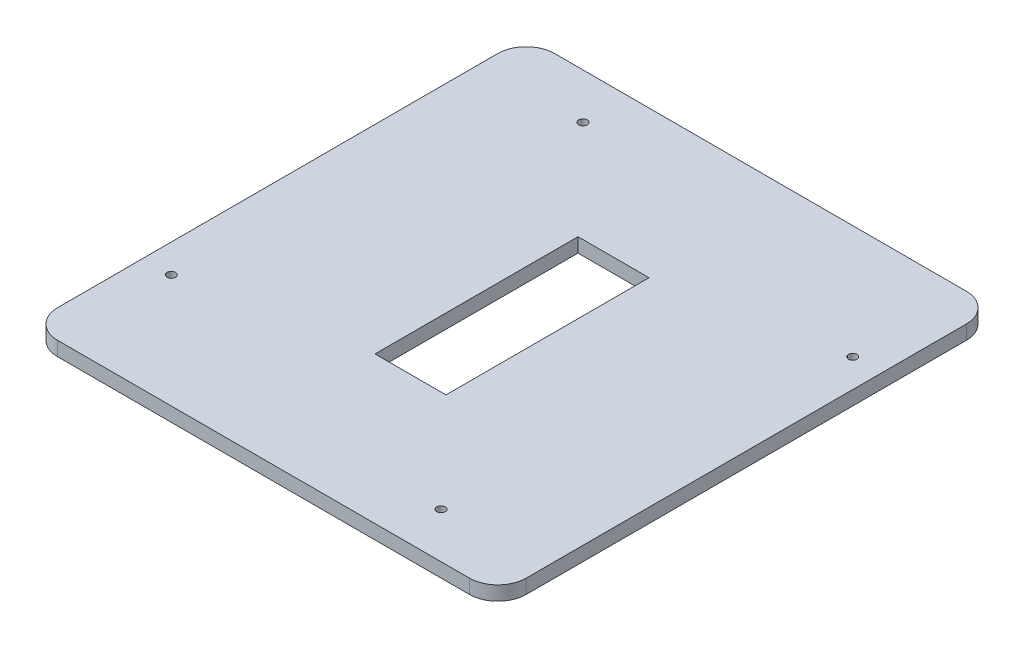
from build123d import *

# Parameters (mm, degrees)
RESSALTO_EXTRUS_O1_DEPTH = 5
ESBO_O2_R                = 1.5
CORTE_EXTRUS_O1_DEPTH    = 5
ESBO_O3_W                = 25
ESBO_O3_H                = 71.5
CORTE_EXTRUS_O2_DEPTH    = 5


with BuildPart() as part:
    # Esboço1 → Ressalto-extrusão1 (new body)
    with BuildSketch(Plane(origin=(0, 0, 0), x_dir=(1, 0, 0), z_dir=(0, 1, 0))):
        with BuildLine():
            Line((-25.463589741, 142.264378701), (119.536410259, 142.264378701))
            ThreePointArc((119.536410259, 142.264378701), (126.607478071, 139.335446513), (129.536410259, 132.264378701))
            Line((129.536410259, 132.264378701), (129.536410259, -22.735621299))
            ThreePointArc((129.536410259, -22.735621299), (126.607478071, -29.806689111), (119.536410259, -32.735621299))
            Line((119.536410259, -32.735621299), (-25.463589741, -32.735621299))
            ThreePointArc((-25.463589741, -32.735621299), (-32.534657553, -29.806689111), (-35.463589741, -22.735621299))
            Line((-35.463589741, -22.735621299), (-35.463589741, 132.264378701))
            ThreePointArc((-35.463589741, 132.264378701), (-32.534657553, 139.335446513), (-25.463589741, 142.264378701))
        make_face()
    extrude(amount=RESSALTO_EXTRUS_O1_DEPTH)

    # Esboço2 → Corte-extrusão1 (cut)
    with BuildSketch(Plane(origin=(0, 5, 0), x_dir=(1, 0, 0), z_dir=(0, 1, 0))):
        with Locations(Location((-25.463589741, 7.264378701, 0), (0, 0, 270))):
            Circle(ESBO_O2_R)
        with Locations(Location((0.536410259, 126.264378701, 0), (0, 0, 270))):
            Circle(ESBO_O2_R)
        with Locations(Location((119.536410259, 102.264378701, 0), (0, 0, 270))):
            Circle(ESBO_O2_R)
        with Locations(Location((93.536410259, -16.735621299, 0), (0, 0, 270))):
            Circle(ESBO_O2_R)
    extrude(amount=-CORTE_EXTRUS_O1_DEPTH, mode=Mode.SUBTRACT)

    # Esboço3 → Corte-extrusão2 (cut)
    with BuildSketch(Plane(origin=(0, 5, 0), x_dir=(1, 0, 0), z_dir=(0, 1, 0))):
        with Locations((47.036410259, 54.764378701)):
            Rectangle(ESBO_O3_W, ESBO_O3_H)
    extrude(amount=-CORTE_EXTRUS_O2_DEPTH, mode=Mode.SUBTRACT)


solid = part.part
